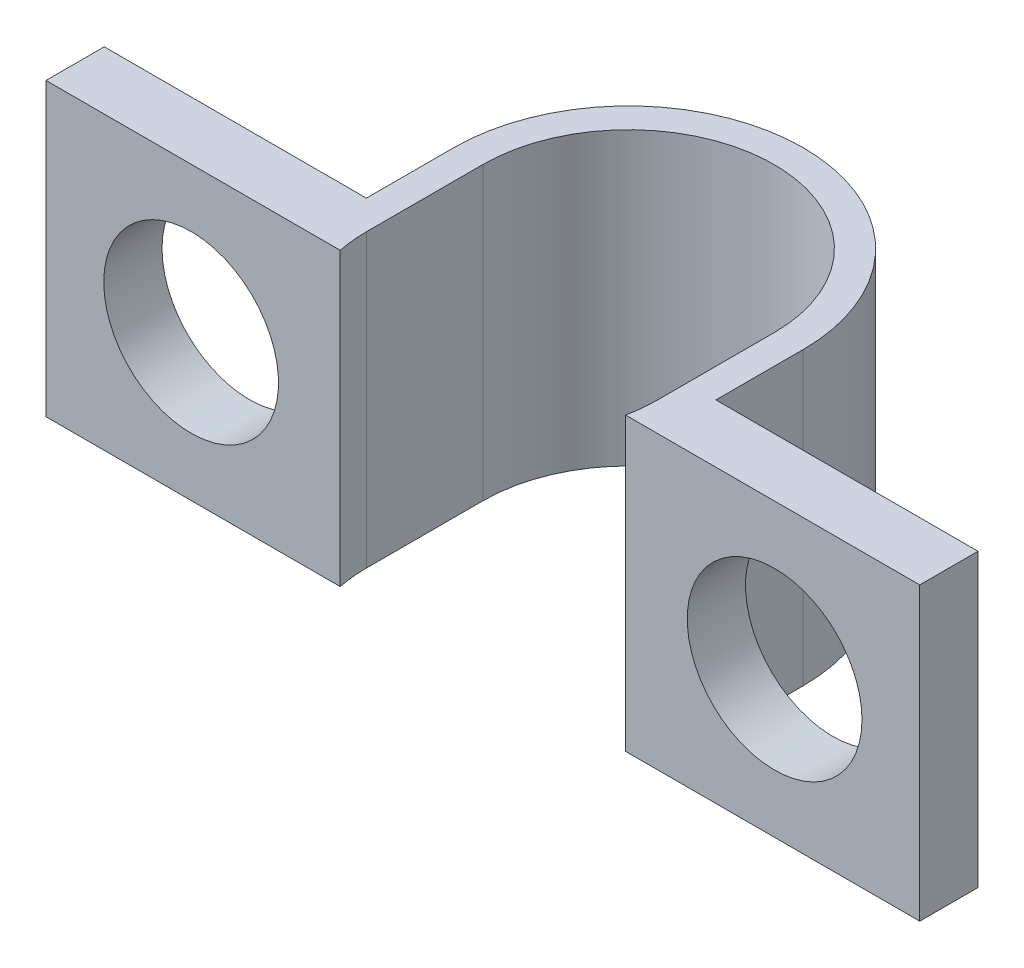
from build123d import *

# Parameters (mm, degrees)
BOSS_EXTRUDE1_DEPTH = 5
SKETCH2_R           = 1.5
CUT_EXTRUDE1_DEPTH  = 11.07472084


with BuildPart() as part:
    # Sketch1 → Boss-Extrude1 (new body)
    with BuildSketch(Plane(origin=(0, 0, 0), x_dir=(1, 0, 0), z_dir=(0, 1, 0))):
        with BuildLine():
            Line((-3, 0.5), (-3, 2))
            ThreePointArc((-3, 2), (0, 5), (3, 2))
            Line((3, 2), (3, 0.5))
            Line((3, 0.5), (7.5, 0.5))
            Line((7.5, 0.5), (7.5, -0.5))
            Line((7.5, -0.5), (2.449489743, -0.5))
            ThreePointArc((2.449489743, -0.5), (2.487340383, -0.251272405), (2.5, 0))
            Line((2.5, 0), (2.5, 2))
            ThreePointArc((2.5, 2), (0, 4.5), (-2.5, 2))
            Line((-2.5, 2), (-2.5, 0))
            ThreePointArc((-2.5, 0), (-2.487340383, -0.251272405), (-2.449489743, -0.5))
            Line((-2.449489743, -0.5), (-7.5, -0.5))
            Line((-7.5, -0.5), (-7.5, 0.5))
            Line((-7.5, 0.5), (-3, 0.5))
        make_face()
    extrude(amount=BOSS_EXTRUDE1_DEPTH)

    # Sketch2 → Cut-Extrude1 (cut, through all)
    with BuildSketch(Plane(origin=(0, 0, -0.5), x_dir=(-1, 0, 0), z_dir=(0, 0, -1))):
        with Locations((5.008421406, 2.5)):
            Circle(SKETCH2_R)
        with Locations(Location((-5.008421406, 2.5, 0), (0, 0, 180))):
            Circle(SKETCH2_R)
    extrude(amount=-CUT_EXTRUDE1_DEPTH, mode=Mode.SUBTRACT)


solid = part.part
